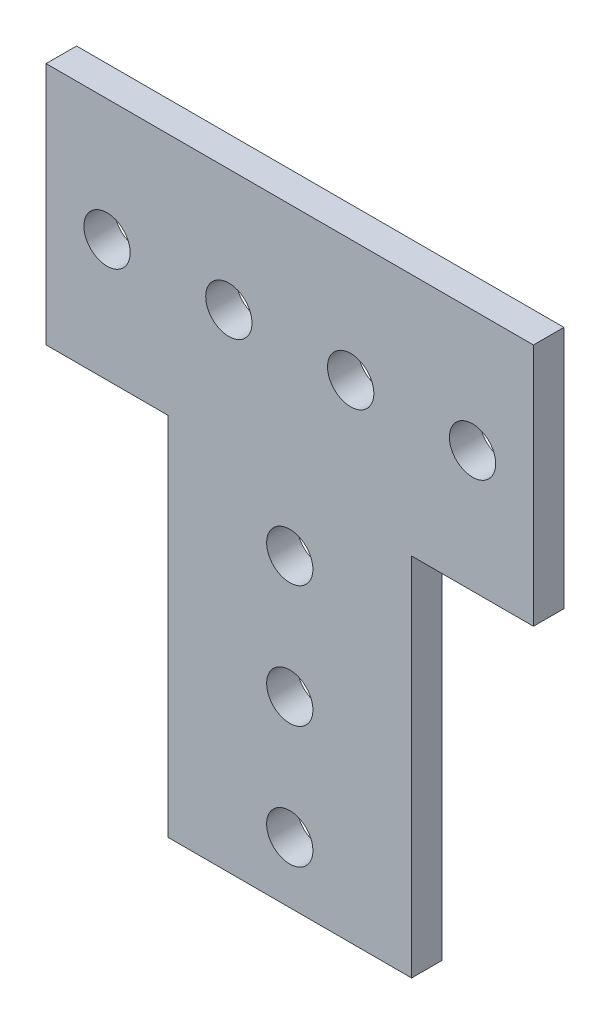
from build123d import *

# Parameters (mm, degrees)
BOSS_EXTRUDE1_DEPTH = 3.175
SKETCH2_R           = 2.413
CUT_EXTRUDE1_DEPTH  = 75.121121315
SKETCH3_R           = 2.413
CUT_EXTRUDE2_DEPTH  = 75.121121315


with BuildPart() as part:
    # Sketch1 → Boss-Extrude1 (new body)
    with BuildSketch(Plane.XY):
        Polygon((0, 0), (0, 38.1), (-12.7, 38.1), (-12.7, 63.5), (38.1, 63.5), (38.1, 38.1), (25.4, 38.1), (25.4, 0), align=None)
    extrude(amount=BOSS_EXTRUDE1_DEPTH)

    # Sketch2 → Cut-Extrude1 (cut, through all)
    with BuildSketch(Plane(origin=(0, 0, 0), x_dir=(-1, 0, 0), z_dir=(0, 0, -1))):
        with Locations((-19.05, 50.8)):
            Circle(SKETCH2_R)
        with Locations((-6.35, 50.8)):
            Circle(SKETCH2_R)
        with Locations((6.35, 50.8)):
            Circle(SKETCH2_R)
        with Locations((-31.75, 50.8)):
            Circle(SKETCH2_R)
    extrude(amount=-CUT_EXTRUDE1_DEPTH, mode=Mode.SUBTRACT)

    # Sketch3 → Cut-Extrude2 (cut, through all)
    with BuildSketch(Plane(origin=(0, 0, 0), x_dir=(-1, 0, 0), z_dir=(0, 0, -1))):
        with Locations((-12.7, 19.05)):
            Circle(SKETCH3_R)
        with Locations((-12.7, 31.75)):
            Circle(SKETCH3_R)
        with Locations((-12.7, 6.35)):
            Circle(SKETCH3_R)
    extrude(amount=-CUT_EXTRUDE2_DEPTH, mode=Mode.SUBTRACT)


solid = part.part
